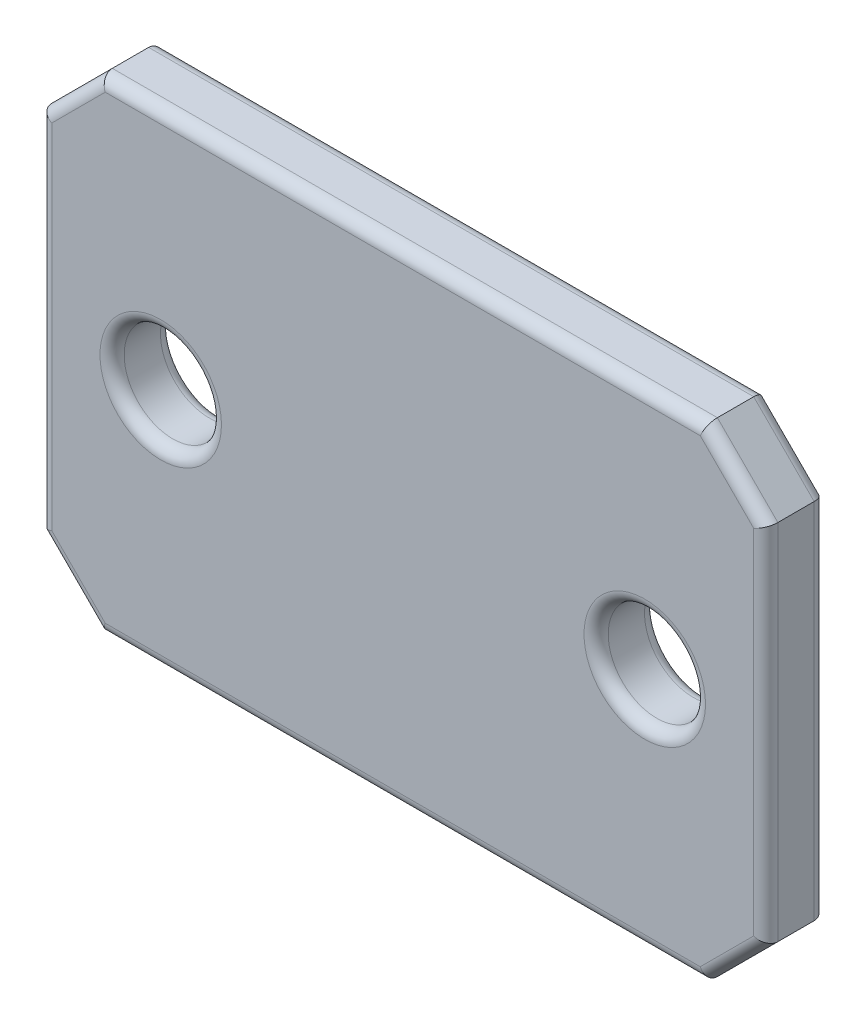
from build123d import *

# Parameters (mm, degrees)
BOSS_EXTRUDE1_DEPTH    = 3.175
F_10_CLEARANCE_HOLE1_D = 5.1054
FILLET1_R              = 0.635


with BuildPart() as part:
    # Sketch1 → Boss-Extrude1 (new body)
    with BuildSketch(Plane.XY):
        Polygon((15.875, 12.7), (-15.875, 12.7), (-19.05, 9.525), (-19.05, -9.525), (-15.875, -12.7), (15.875, -12.7), (19.05, -9.525), (19.05, 9.525), align=None)
    extrude(amount=BOSS_EXTRUDE1_DEPTH)

    # #10 Clearance Hole1 (through all)
    with Locations(Plane.XY.offset(3.175)):
        with Locations((12.7, 0), (-12.7, 0)):
            Hole(F_10_CLEARANCE_HOLE1_D / 2)

    # Fillet1
    fillet1_edges = [part.edges().sort_by_distance(p)[0] for p in [
        (-17.4625, -11.1125, 3.175),
        (-19.05, 0, 0),
        (-17.4625, 11.1125, 0),
        (0, -12.7, 3.175),
        (17.4625, -11.1125, 3.175),
        (19.05, 0, 3.175),
        (17.4625, 11.1125, 3.175),
        (0, 12.7, 3.175),
        (-10.1473, 0, 3.175),
        (-10.1473, 0, 0),
        (15.2527, 0, 3.175),
        (15.2527, 0, 0),
        (-17.4625, 11.1125, 3.175),
        (-19.05, 0, 3.175),
        (0, 12.7, 0),
        (17.4625, 11.1125, 0),
        (19.05, 0, 0),
        (17.4625, -11.1125, 0),
        (0, -12.7, 0),
        (-17.4625, -11.1125, 0),
    ]]
    fillet(fillet1_edges, radius=FILLET1_R)


solid = part.part
